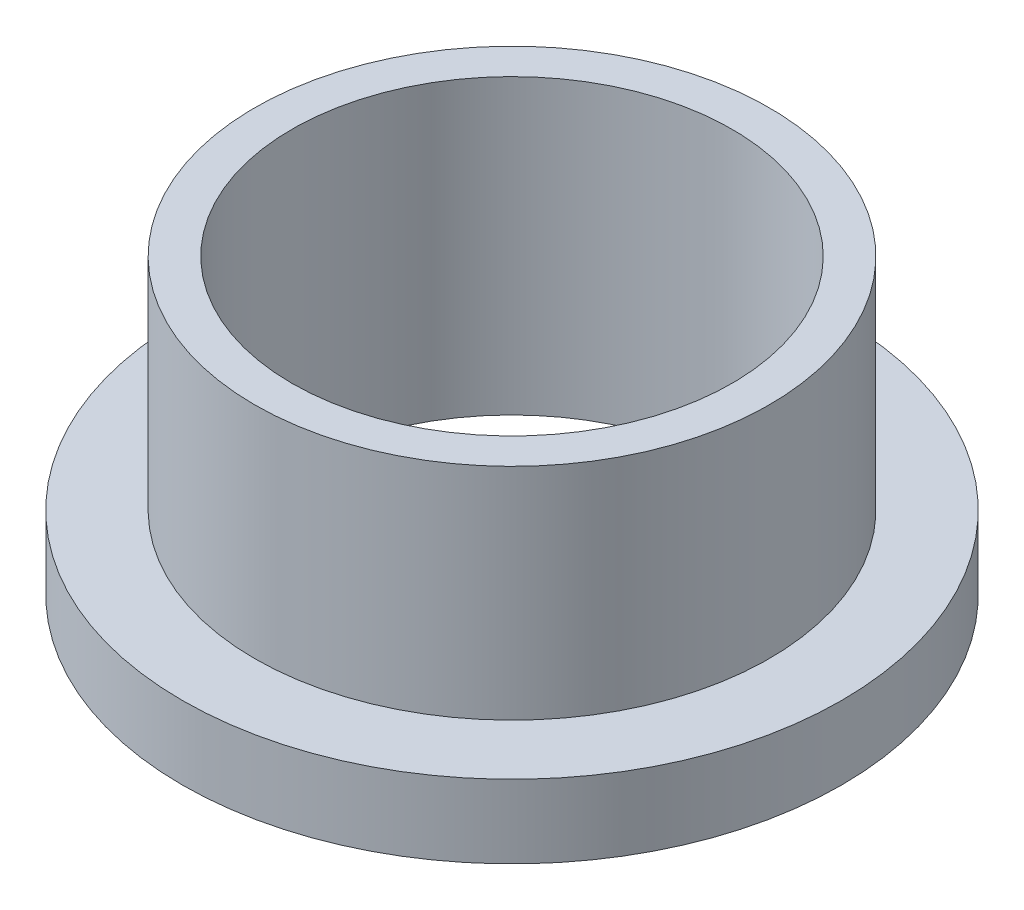
from build123d import *

# Parameters (mm, degrees)
SKETCH2_R           = 11.1506
SKETCH2_R_2         = 9.5377
BOSS_EXTRUDE1_DEPTH = 12.7
SKETCH3_R           = 14.2875
SKETCH3_R_2         = 11.1506
BOSS_EXTRUDE2_DEPTH = 3.175


with BuildPart() as part:
    # Sketch2 → Boss-Extrude1 (new body)
    with BuildSketch(Plane(origin=(0, 0, 0), x_dir=(1, 0, 0), z_dir=(0, 1, 0))):
        with Locations(Location((0, 0, 0), (0, 0, 270))):
            Circle(SKETCH2_R)
        with Locations(Location((0, 0, 0), (0, 0, 270))):
            Circle(SKETCH2_R_2, mode=Mode.SUBTRACT)
    extrude(amount=BOSS_EXTRUDE1_DEPTH)

    # Sketch3 → Boss-Extrude2 (add)
    with BuildSketch(Plane(origin=(0, 0, 0), x_dir=(1, 0, 0), z_dir=(0, 1, 0))):
        with Locations(Location((0, 0, 0), (0, 0, 270))):
            Circle(SKETCH3_R)
        with Locations(Location((0, 0, 0), (0, 0, 270))):
            Circle(SKETCH3_R_2, mode=Mode.SUBTRACT)
    extrude(amount=BOSS_EXTRUDE2_DEPTH)


solid = part.part
